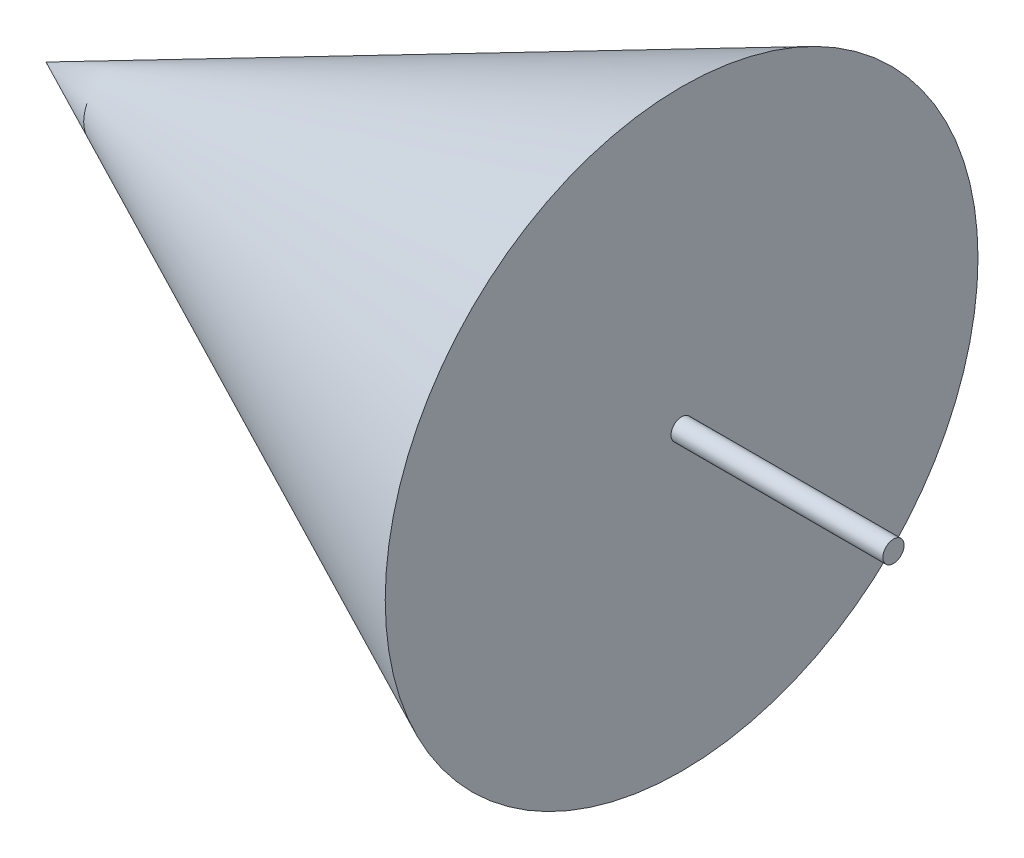
from build123d import *


with BuildPart() as part:
    # Esquisse1 → Révolution1 (revolve)
    with BuildSketch(Plane.XY):
        Polygon((0, 0), (6, 2.797845949), (6, 0.1), (8, 0.1), (8, 0), align=None)
    revolve(axis=Axis((0, 0, 0), (1, 0, 0)))


solid = part.part
